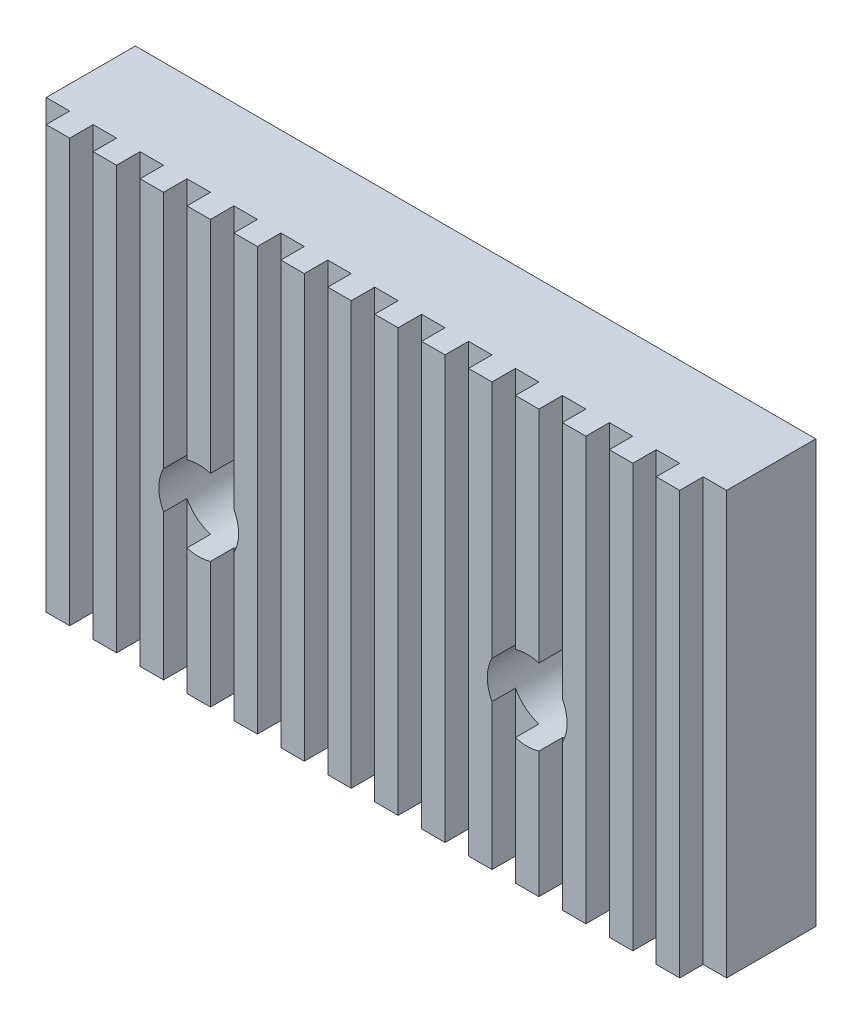
from build123d import *

# Parameters (mm, degrees)
SKETCH_1_W          = 29
SKETCH_1_H          = 18
SKETCH_1_R          = 1.7
EXTRUDE_1_DEPTH     = 4.8
SKETCH_2_W          = 0.5
SKETCH_2_H          = 1
CUT_EXTRUDE_1_DEPTH = 35.467956133


with BuildPart() as part:
    # 草图1 → 凸台-拉伸1 (new body)
    with BuildSketch(Plane.XY):
        with Locations((14.5, 9)):
            Rectangle(SKETCH_1_W, SKETCH_1_H)
        with Locations((21.5, 7)):
            Circle(SKETCH_1_R, mode=Mode.SUBTRACT)
        with Locations(Location((7.5, 7, 0), (0, 0, 180))):
            Circle(SKETCH_1_R, mode=Mode.SUBTRACT)
    extrude(amount=EXTRUDE_1_DEPTH)

    # 草图2 → 切除-拉伸1 (cut, through all)
    with BuildSketch(Plane(origin=(0, 18, 0), x_dir=(1, 0, 0), z_dir=(0, 1, 0))):
        Polygon((0, -4.8), (1, -4.8), (1, -3.8), (0.5, -3.8), (0, -3.8), align=None)
        Polygon((2, -4.8), (3, -4.8), (3, -3.8), (2.5, -3.8), (2, -3.8), align=None)
        Polygon((4, -4.8), (5, -4.8), (5, -3.8), (4.5, -3.8), (4, -3.8), align=None)
        Polygon((6, -4.8), (7, -4.8), (7, -3.8), (6.5, -3.8), (6, -3.8), align=None)
        Polygon((8, -4.8), (9, -4.8), (9, -3.8), (8.5, -3.8), (8, -3.8), align=None)
        Polygon((10, -4.8), (11, -4.8), (11, -3.8), (10.5, -3.8), (10, -3.8), align=None)
        Polygon((12, -4.8), (13, -4.8), (13, -3.8), (12.5, -3.8), (12, -3.8), align=None)
        with Locations((14.75, -4.3)):
            Rectangle(SKETCH_2_W, SKETCH_2_H)
        with Locations((14.25, -4.3)):
            Rectangle(SKETCH_2_W, SKETCH_2_H)
        Polygon((16, -3.8), (16, -4.8), (17, -4.8), (17, -3.8), (16.5, -3.8), align=None)
        Polygon((18, -3.8), (18, -4.8), (19, -4.8), (19, -3.8), (18.5, -3.8), align=None)
        Polygon((20, -3.8), (20, -4.8), (21, -4.8), (21, -3.8), (20.5, -3.8), align=None)
        Polygon((22, -3.8), (22, -4.8), (23, -4.8), (23, -3.8), (22.5, -3.8), align=None)
        Polygon((24, -3.8), (24, -4.8), (25, -4.8), (25, -3.8), (24.5, -3.8), align=None)
        Polygon((26, -3.8), (26, -4.8), (27, -4.8), (27, -3.8), (26.5, -3.8), align=None)
        Polygon((28, -3.8), (28, -4.8), (29, -4.8), (29, -3.8), (28.5, -3.8), align=None)
    extrude(amount=-CUT_EXTRUDE_1_DEPTH, mode=Mode.SUBTRACT)


solid = part.part
